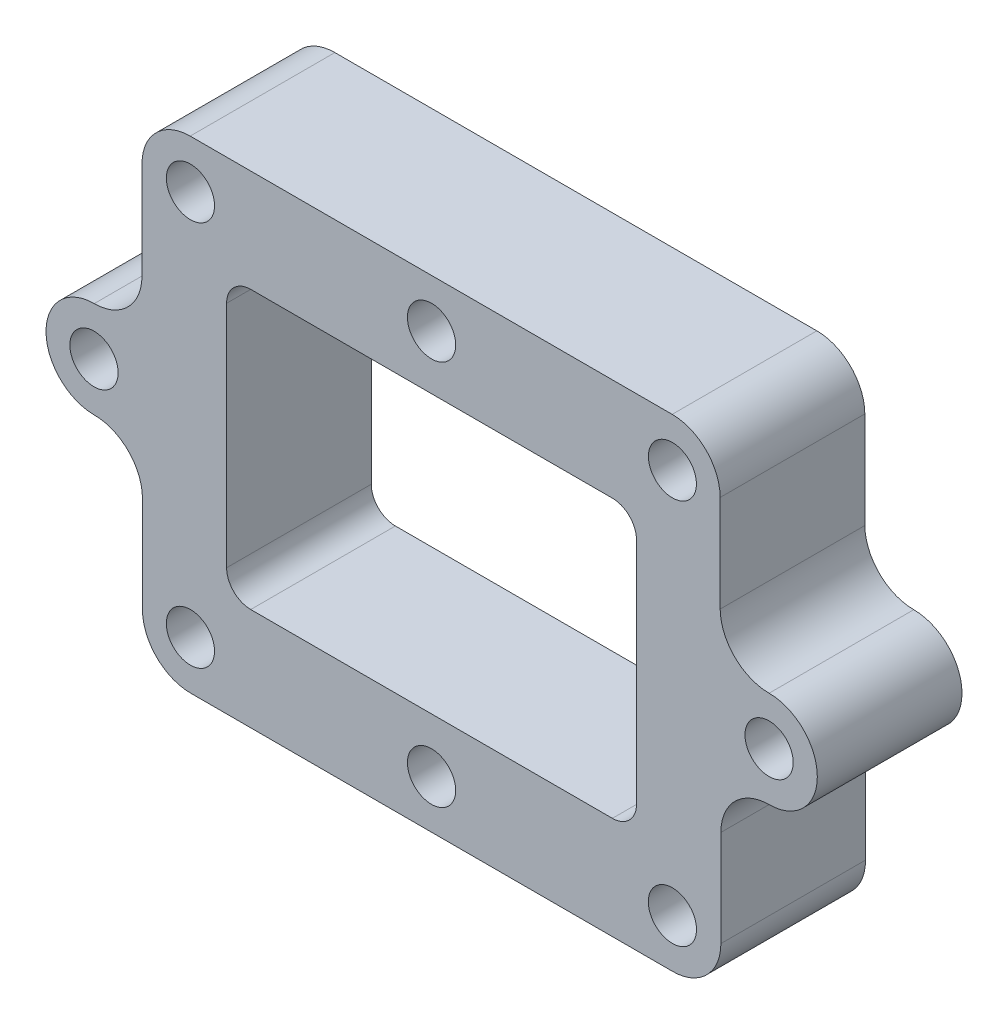
from build123d import *

# Parameters (mm, degrees)
SKETCH1_R           = 6.35
SKETCH1_R_2         = 6.321908291
BOSS_EXTRUDE1_DEPTH = 38.1


with BuildPart() as part:
    # Sketch1 → Boss-Extrude1 (new body)
    with BuildSketch(Plane.XY):
        with BuildLine():
            Line((25.4632885, -63.5), (152.4, -63.5))
            ThreePointArc((152.4, -63.5), (161.380256121, -59.780256121), (165.1, -50.8))
            Line((165.1, -50.8), (165.1, -25.442050481))
            ThreePointArc((165.1, -25.442050481), (168.819743879, -16.46179436), (177.8, -12.742050481))
            ThreePointArc((177.8, -12.742050481), (190.5, -0.042050481), (177.8, 12.657949519))
            ThreePointArc((177.8, 12.657949519), (168.735231625, 16.383513436), (164.910134501, 25.406732606))
            Line((164.910134501, 25.406732606), (164.910134501, 50.8632885))
            ThreePointArc((164.910134501, 50.8632885), (161.208927395, 59.798792893), (152.273423001, 63.5))
            Line((152.273423001, 63.5), (25.3367115, 63.5))
            ThreePointArc((25.3367115, 63.5), (16.356455379, 59.780256121), (12.6367115, 50.8))
            Line((12.6367115, 50.8), (12.6367115, 25.406732606))
            ThreePointArc((12.6367115, 25.406732606), (9.016254993, 16.402760527), (0.0632885, 12.657949519))
            ThreePointArc((0.0632885, 12.657949519), (-12.6367115, -0.042050481), (0.0632885, -12.742050481))
            ThreePointArc((0.0632885, -12.742050481), (9.043544621, -16.46179436), (12.7632885, -25.442050481))
            Line((12.7632885, -25.442050481), (12.7632885, -50.8))
            ThreePointArc((12.7632885, -50.8), (16.483032379, -59.780256121), (25.4632885, -63.5))
        make_face()
        with Locations(Location((0, 0, 0), (0, 0, 180))):
            Circle(SKETCH1_R, mode=Mode.SUBTRACT)
        with Locations(Location((177.8, 0, 0), (0, 0, 180))):
            Circle(SKETCH1_R, mode=Mode.SUBTRACT)
        with Locations(Location((88.9, 50.8, 0), (0, 0, 180))):
            Circle(SKETCH1_R, mode=Mode.SUBTRACT)
        with Locations(Location((88.9, -50.8, 0), (0, 0, 180))):
            Circle(SKETCH1_R, mode=Mode.SUBTRACT)
        with Locations(Location((152.3367115, 50.8, 0), (0, 0, 180))):
            Circle(SKETCH1_R_2, mode=Mode.SUBTRACT)
        with Locations(Location((25.4, 50.8, 0), (0, 0, 180))):
            Circle(SKETCH1_R, mode=Mode.SUBTRACT)
        with Locations(Location((25.4, -50.8, 0), (0, 0, 180))):
            Circle(SKETCH1_R, mode=Mode.SUBTRACT)
        with Locations(Location((152.3367115, -50.8, 0), (0, 0, 180))):
            Circle(SKETCH1_R, mode=Mode.SUBTRACT)
        with BuildLine():
            Line((34.925, 30.1625), (34.925, -30.1625))
            ThreePointArc((34.925, -30.1625), (36.784871939, -34.652628061), (41.275, -36.5125))
            Line((41.275, -36.5125), (136.525, -36.5125))
            ThreePointArc((136.525, -36.5125), (141.015128061, -34.652628061), (142.875, -30.1625))
            Line((142.875, -30.1625), (142.875, 30.1625))
            ThreePointArc((142.875, 30.1625), (141.015128061, 34.652628061), (136.525, 36.5125))
            Line((136.525, 36.5125), (41.275, 36.5125))
            ThreePointArc((41.275, 36.5125), (36.784871939, 34.652628061), (34.925, 30.1625))
        make_face(mode=Mode.SUBTRACT)
    extrude(amount=BOSS_EXTRUDE1_DEPTH)


solid = part.part
